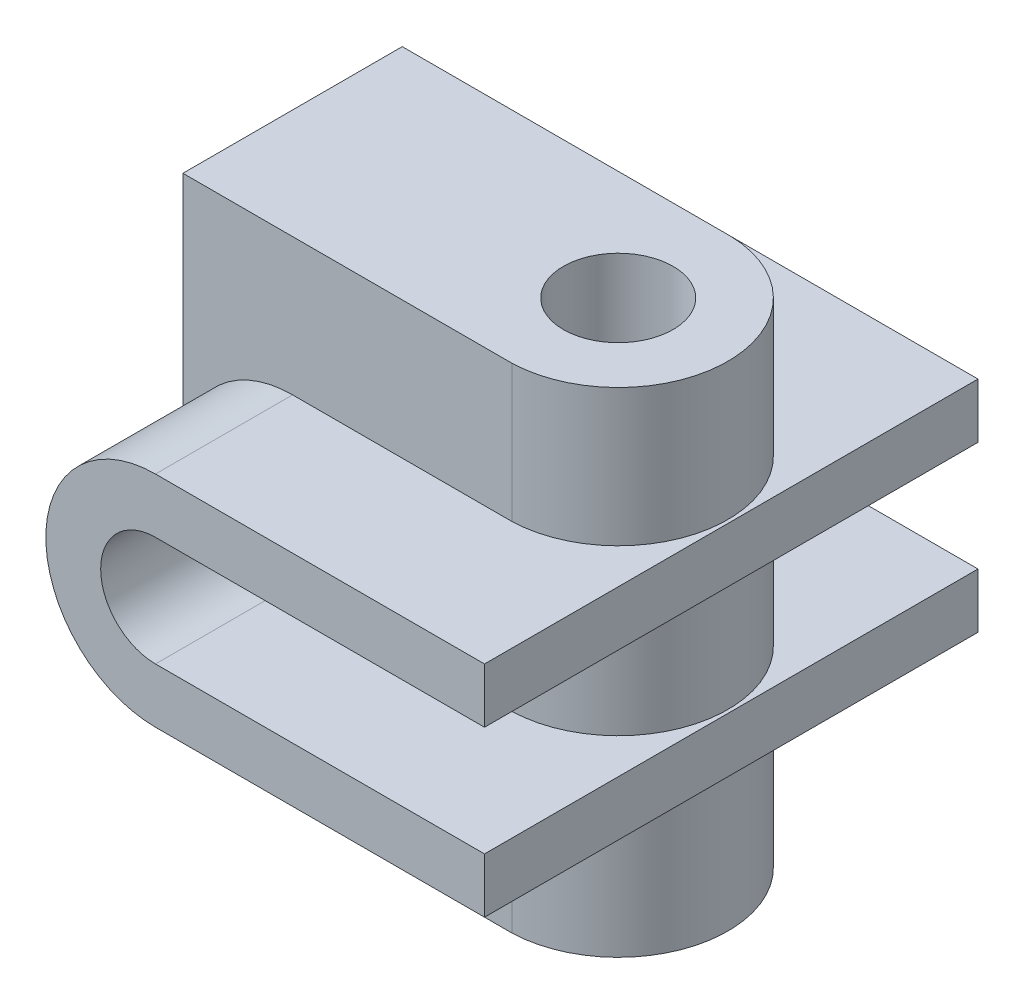
from build123d import *

# Parameters (mm, degrees)
EXTRUDE_1_DEPTH      = 90
EXTRUDE_3_DEPTH      = 45
EXTRUDE_3_DEPTH_BACK = 45
SKETCH_2_R           = 10


with BuildPart() as part:
    # Эскиз1 → Вытянуть-Тонкостенный1 (new body)
    with BuildSketch(Plane.XY):
        with BuildLine():
            Line((60, 20), (0, 20))
            ThreePointArc((0, 20), (-20, 0), (0, -20))
            Line((0, -20), (60, -20))
            Line((60, -20), (60, -10))
            Line((60, -10), (0, -10))
            ThreePointArc((0, -10), (-10, 0), (0, 10))
            Line((0, 10), (60, 10))
            Line((60, 10), (60, 20))
        make_face()
    extrude(amount=EXTRUDE_1_DEPTH)

    # Эскиз2 → Бобышка-Вытянуть3 (add, two sides: drawn at the far end of the back side and taken through both)
    with BuildSketch(Plane(origin=(0, 0, 0), x_dir=(1, 0, 0), z_dir=(0, 1, 0)).offset(-EXTRUDE_3_DEPTH_BACK)):
        with BuildLine():
            Line((-20, -25), (-20, -65))
            Line((-20, -65), (40, -65))
            ThreePointArc((40, -65), (59.396542923, -45), (40, -25))
            Line((40, -25), (-20, -25))
        make_face()
        with Locations(Location((39.387155672, -45, 0), (0, 0, 270))):
            Circle(SKETCH_2_R, mode=Mode.SUBTRACT)
    extrude(amount=EXTRUDE_3_DEPTH + EXTRUDE_3_DEPTH_BACK)


solid = part.part
